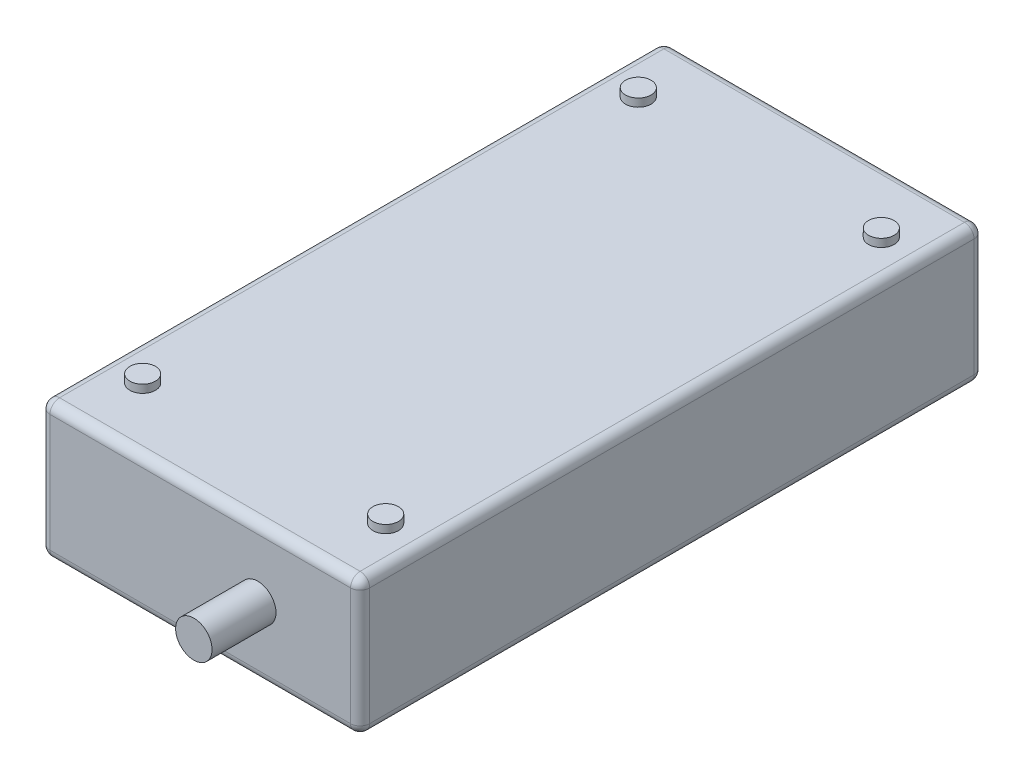
from build123d import *

# Parameters (mm, degrees)
SKETCH1_W           = 100
SKETCH1_H           = 42.77
BOSS_EXTRUDE1_DEPTH = 195
SKETCH2_R           = 4
BOSS_EXTRUDE2_DEPTH = 2.5
FILLET1_R           = 3
SKETCH3_R           = 5.7
BOSS_EXTRUDE3_DEPTH = 20
CUT_EXTRUDE1_DEPTH  = 23
SKETCH5_W           = 2.767644168
SKETCH5_H           = 5.042715582
SKETCH5_W_2         = 2.583134557
SKETCH5_H_2         = 3.628689021
BOSS_EXTRUDE4_DEPTH = 20
SKETCH6_W           = 2.767644168
SKETCH6_H           = 5.042715582
BOSS_EXTRUDE5_DEPTH = 3


with BuildPart() as part:
    # Sketch1 → Boss-Extrude1 (new body)
    with BuildSketch(Plane.XY):
        with Locations((20.723910559, -0.985431434)):
            Rectangle(SKETCH1_W, SKETCH1_H)
    extrude(amount=BOSS_EXTRUDE1_DEPTH)

    # Sketch2 → Boss-Extrude2 (add)
    with BuildSketch(Plane(origin=(0, 20.399568566, 0), x_dir=(1, 0, 0), z_dir=(0, 1, 0))):
        with BuildLine():
            ThreePointArc((62.723910559, -20), (61.552337684, -17.171572875), (58.723910559, -16))
            Line((58.723910559, -16), (58.723910559, -20))
            Line((58.723910559, -20), (62.723910559, -20))
        make_face()
        with BuildLine():
            Line((58.723910559, -20), (58.723910559, -16))
            ThreePointArc((58.723910559, -16), (55.895483435, -22.828427125), (62.723910559, -20))
            Line((62.723910559, -20), (58.723910559, -20))
        make_face()
        with Locations(Location((-17.276089441, -20, 0), (0, 0, 270))):
            Circle(SKETCH2_R)
        with Locations(Location((-17.276089441, -175, 0), (0, 0, 90))):
            Circle(SKETCH2_R)
        with Locations(Location((58.723910559, -175, 0), (0, 0, 270))):
            Circle(SKETCH2_R)
    extrude(amount=BOSS_EXTRUDE2_DEPTH)

    # Fillet1
    fillet1_edges = [part.edges().sort_by_distance(p)[0] for p in [
        (70.723910559, -0.985431434, 195),
        (20.723910559, 20.399568566, 195),
        (-29.276089441, -0.985431434, 195),
        (20.723910559, 20.399568566, 0),
        (70.723910559, -0.985431434, 0),
        (20.723910559, -22.370431434, 0),
        (-29.276089441, -0.985431434, 0),
        (20.723910559, -22.370431434, 195),
        (-29.276089441, 20.399568566, 97.5),
        (70.723910559, 20.399568566, 97.5),
        (70.723910559, -22.370431434, 97.5),
        (-29.276089441, -22.370431434, 97.5),
    ]]
    fillet(fillet1_edges, radius=FILLET1_R)

    # Sketch3 → Boss-Extrude3 (add)
    with BuildSketch(Plane.XY.offset(195)):
        with Locations((38.723910559, -0.985431434)):
            Circle(SKETCH3_R)
    extrude(amount=BOSS_EXTRUDE3_DEPTH)

    # Sketch4 → Cut-Extrude1 (cut)
    with BuildSketch(Plane(origin=(0, 0, 0), x_dir=(-1, 0, 0), z_dir=(0, 0, -1))):
        Polygon((-50.723910559, 0), (-50.723910559, -3), (-45.097599839, -8.62631072), (-31.35022128, -8.62631072), (-25.723910559, -3), (-25.723910559, 9), (-50.723910559, 9), align=None)
    extrude(amount=-CUT_EXTRUDE1_DEPTH, mode=Mode.SUBTRACT)

    # Sketch5 → Boss-Extrude4 (add)
    with BuildSketch(Plane(origin=(0, 0, 23), x_dir=(-1, 0, 0), z_dir=(0, 0, -1))):
        with Locations((-37.98516428, -2.521357791)):
            Rectangle(SKETCH5_W, SKETCH5_H)
        with Locations((-45.273293924, 3.598484544)):
            Rectangle(SKETCH5_W_2, SKETCH5_H_2)
        with Locations((-30.697034638, 3.598484544)):
            Rectangle(SKETCH5_W_2, SKETCH5_H_2)
    extrude(amount=BOSS_EXTRUDE4_DEPTH)

    # Sketch6 → Boss-Extrude5 (add)
    with BuildSketch(Plane(origin=(0, 0, 3), x_dir=(-1, 0, 0), z_dir=(0, 0, -1))):
        with Locations((-37.98516428, -2.521357791)):
            Rectangle(SKETCH6_W, SKETCH6_H)
    extrude(amount=BOSS_EXTRUDE5_DEPTH)


solid = part.part
